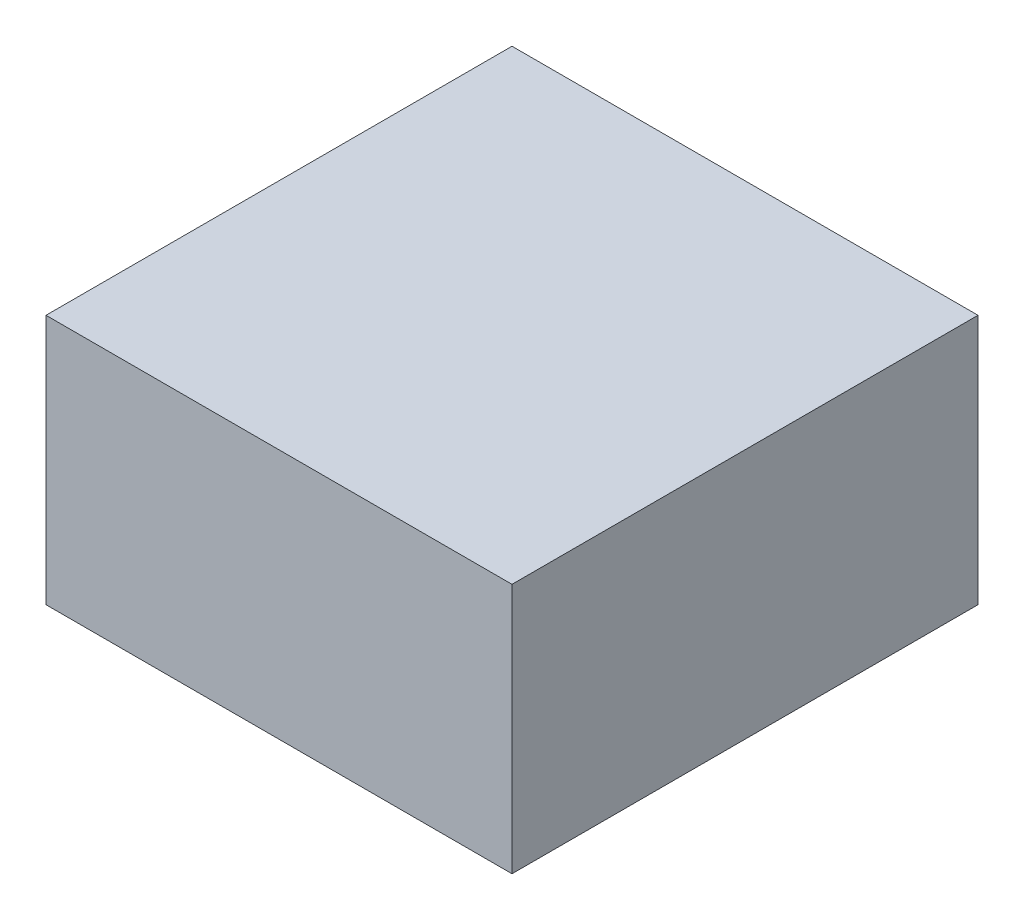
from build123d import *

# Parameters (mm, degrees)
IZIM1_W                     = 145
IZIM1_H                     = 145
Y_KSEKLIK_EKSTR_ZYON1_DEPTH = 78


with BuildPart() as part:
    # Çizim1 → Yükseklik-Ekstrüzyon1 (new body)
    with BuildSketch(Plane(origin=(0, 0, 0), x_dir=(1, 0, 0), z_dir=(0, 1, 0))):
        Rectangle(IZIM1_W, IZIM1_H)
    extrude(amount=Y_KSEKLIK_EKSTR_ZYON1_DEPTH)


solid = part.part
